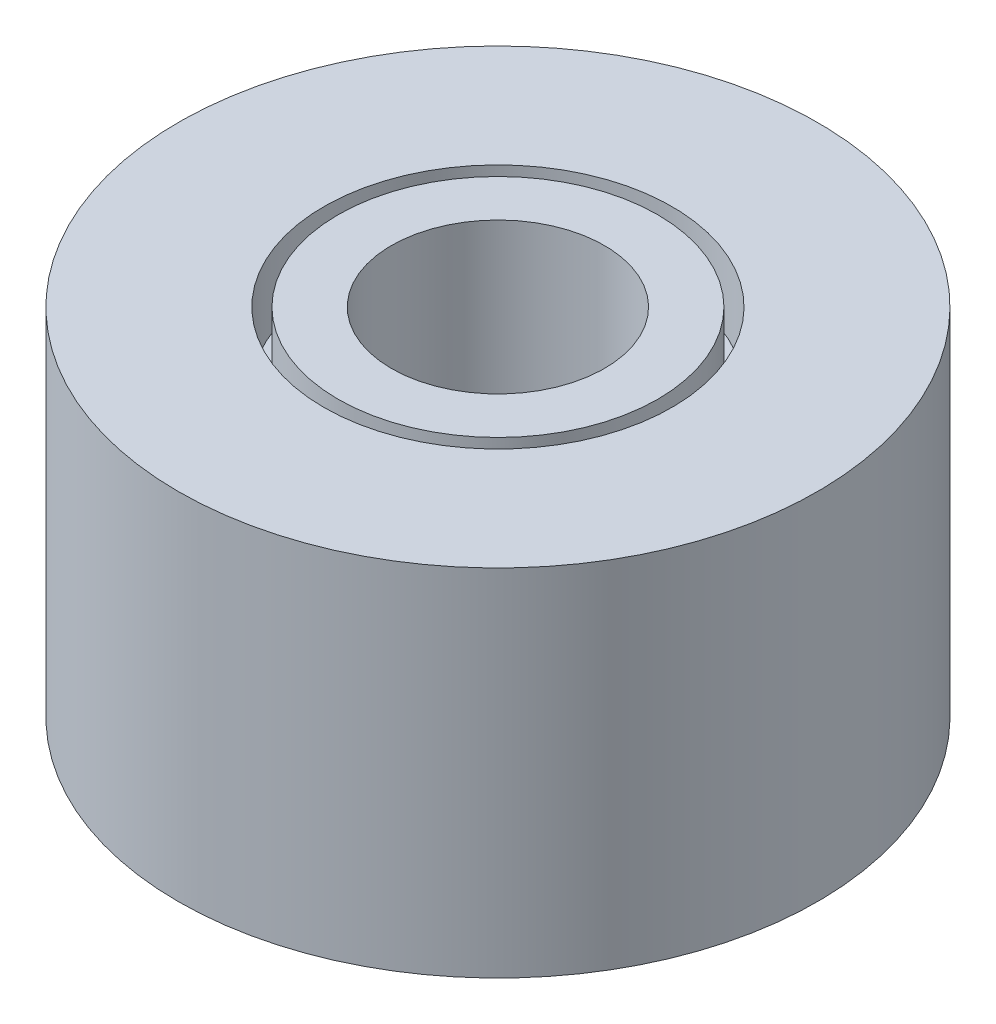
from build123d import *

# Parameters (mm, degrees)
SKETCH_1_R          = 4.5
SKETCH_1_R_2        = 1.5
EXTRUDE_1_DEPTH     = 5
SKETCH_1_3_R        = 2.45
SKETCH_1_3_R_2      = 2.25
CUT_EXTRUDE_1_DEPTH = 1
CUT_EXTRUDE_START   = 4
SKETCH_1_4_R        = 2.45
SKETCH_1_4_R_2      = 2.25
CUT_EXTRUDE_2_DEPTH = 1


with BuildPart() as part:
    # 草图1 → 凸台-拉伸1 (new body)
    with BuildSketch(Plane(origin=(0, 0, 0), x_dir=(1, 0, 0), z_dir=(0, 1, 0))):
        with Locations(Location((0, 0, 0), (0, 0, 270))):
            Circle(SKETCH_1_R)
        with Locations(Location((0, 0, 0), (0, 0, 270))):
            Circle(SKETCH_1_R_2, mode=Mode.SUBTRACT)
    extrude(amount=EXTRUDE_1_DEPTH)

    # 草图1<3> → 切除-拉伸-薄壁1 (cut)
    with BuildSketch(Plane(origin=(0, 0, 0), x_dir=(1, 0, 0), z_dir=(0, 1, 0))):
        Circle(SKETCH_1_3_R)
        Circle(SKETCH_1_3_R_2, mode=Mode.SUBTRACT)
    extrude(amount=CUT_EXTRUDE_1_DEPTH, mode=Mode.SUBTRACT)

    # 草图1<4> → 切除-拉伸-薄壁2 (cut)
    with BuildSketch(Plane(origin=(0, 0, 0), x_dir=(1, 0, 0), z_dir=(0, 1, 0)).offset(CUT_EXTRUDE_START)):
        Circle(SKETCH_1_4_R)
        Circle(SKETCH_1_4_R_2, mode=Mode.SUBTRACT)
    extrude(amount=CUT_EXTRUDE_2_DEPTH, mode=Mode.SUBTRACT)


solid = part.part
